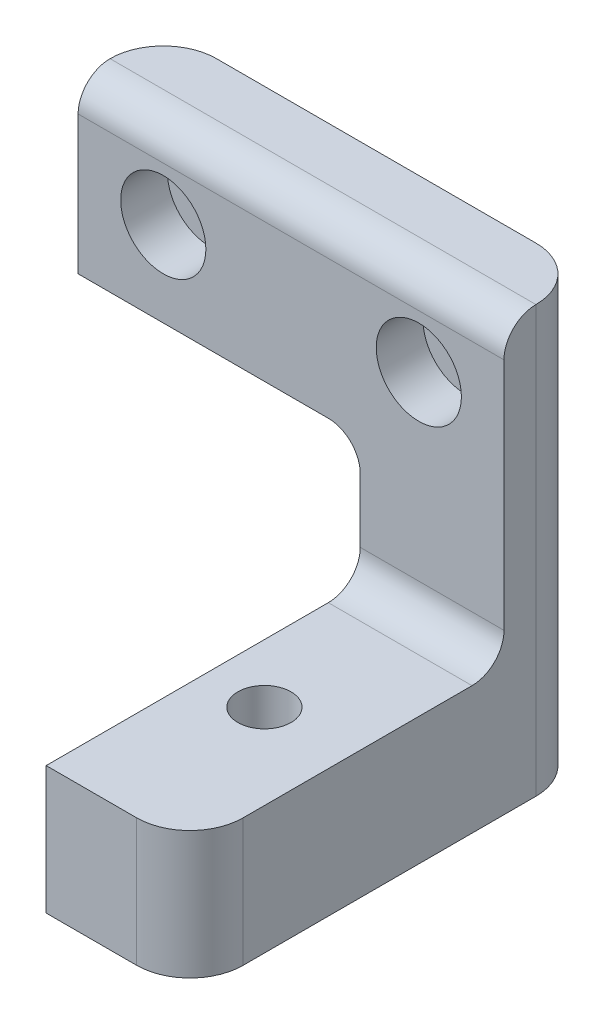
from build123d import *

# Parameters (mm, degrees)
SKETCH1_W                                           = 40
SKETCH1_H                                           = 37.5
BOSS_EXTRUDE1_DEPTH                                 = 40
CUT_EXTRUDE1_REACH                                  = 61.595
SKETCH2_W                                           = 29.5
SKETCH2_H                                           = 28
FILLET1_R                                           = 3
M6_TAPPED_HOLE1_D                                   = 5
M6_TAPPED_HOLE1_CSINK_D                             = 6.05
M6_TAPPED_HOLE1_CSINK_ANGLE                         = 90
FILLET2_R                                           = 5
CUT_EXTRUDE2_REACH                                  = 50.493
SKETCH7_W                                           = 13
SKETCH7_H                                           = 29.5
CUT_EXTRUDE3_REACH                                  = 50.493
SKETCH8_W                                           = 29.5
SKETCH8_H                                           = 37
CUT_EXTRUDE4_REACH                                  = 61.595
SKETCH9_W                                           = 8
SKETCH9_H                                           = 23.997787144
FILLET5_R                                           = 3
CBORE_FOR_M4_HEX_SOCKET_HEAD_CAP_SCREW1_D           = 4.3
CBORE_FOR_M4_HEX_SOCKET_HEAD_CAP_SCREW1_CBORE_D     = 8
CBORE_FOR_M4_HEX_SOCKET_HEAD_CAP_SCREW1_CBORE_DEPTH = 4.4


with BuildPart() as part:
    # Sketch1 → Boss-Extrude1 (new body)
    with BuildSketch(Plane(origin=(0, 0, 0), x_dir=(1, 0, 0), z_dir=(0, 1, 0))):
        Rectangle(SKETCH1_W, SKETCH1_H)
    extrude(amount=-BOSS_EXTRUDE1_DEPTH)

    # Sketch2 → Cut-Extrude1 (cut, up to next)
    with BuildSketch(Plane(origin=(20, 0, 0), x_dir=(0, 0, -1), z_dir=(1, 0, 0)), mode=Mode.PRIVATE) as cut_extrude1_sk1:
        with Locations((-4, -14)):
            Rectangle(SKETCH2_W, SKETCH2_H)
    cut_extrude1_tool1 = extrude(cut_extrude1_sk1.sketch, amount=-CUT_EXTRUDE1_REACH, mode=Mode.PRIVATE) & part.part
    add(cut_extrude1_tool1.solids().sort_by_distance((20, -14, 4))[0], mode=Mode.SUBTRACT)

    # Fillet1
    fillet1_edges = [part.edges().sort_by_distance(p)[0] for p in [
        (0, 0, -10.75),
        (0, -28, -10.75),
    ]]
    fillet(fillet1_edges, radius=FILLET1_R)

    # M6 Tapped Hole1 (through all)
    with Locations(Plane(origin=(0, -40, 0), x_dir=(-1, 0, 0), z_dir=(0, -1, 0))):
        with Locations((-12, -3.75)):
            CounterSinkHole(M6_TAPPED_HOLE1_D / 2, M6_TAPPED_HOLE1_CSINK_D / 2, counter_sink_angle=M6_TAPPED_HOLE1_CSINK_ANGLE)

    # Fillet2
    fillet2_edges = [part.edges().sort_by_distance(p)[0] for p in [
        (20, -20, -18.75),
        (20, -34, 18.75),
        (-20, -34, 18.75),
        (-20, -20, -18.75),
    ]]
    fillet(fillet2_edges, radius=FILLET2_R)

    # Sketch7 → Cut-Extrude2 (cut, up to next)
    with BuildSketch(Plane(origin=(0, 0, 0), x_dir=(1, 0, 0), z_dir=(0, 1, 0)), mode=Mode.PRIVATE) as cut_extrude2_sk1:
        with Locations((0, -4)):
            Rectangle(SKETCH7_W, SKETCH7_H)
    cut_extrude2_tool1 = extrude(cut_extrude2_sk1.sketch, amount=-CUT_EXTRUDE2_REACH, mode=Mode.PRIVATE) & part.part
    add(cut_extrude2_tool1.solids().sort_by_distance((0, 0, 4))[0], mode=Mode.SUBTRACT)

    # Sketch8 → Cut-Extrude3 (cut, up to next)
    with BuildSketch(Plane(origin=(0, 0, 0), x_dir=(0, 0, -1), z_dir=(1, 0, 0)), mode=Mode.PRIVATE) as cut_extrude3_sk1:
        with Locations((-4, -21.5)):
            Rectangle(SKETCH8_W, SKETCH8_H)
    cut_extrude3_tool1 = extrude(cut_extrude3_sk1.sketch, amount=-CUT_EXTRUDE3_REACH, mode=Mode.PRIVATE) & part.part
    add(cut_extrude3_tool1.solids().sort_by_distance((0, -21.5, 4))[0], mode=Mode.SUBTRACT)

    # Cut-Extrude4: up to this face of the body (flat: up to its plane)
    cut_extrude4_end = Plane(part.part.faces().sort_by_distance((6.5, -33.963805531, 3.923597235))[0])
    # Sketch9 → Cut-Extrude4 (cut, up to the picked face)
    with BuildSketch(Plane.ZY.offset(20), mode=Mode.PRIVATE) as cut_extrude4_sk1:
        with Locations((-14.75, -28.001106428)):
            Rectangle(SKETCH9_W, SKETCH9_H)
    cut_extrude4_tool1 = split(extrude(cut_extrude4_sk1.sketch, amount=-CUT_EXTRUDE4_REACH, mode=Mode.PRIVATE), bisect_by=cut_extrude4_end, keep=Keep.BOTH, mode=Mode.PRIVATE)
    add(cut_extrude4_tool1.solids().sort_by(Axis((-20, -28.001106, -14.75), (1, 0, 0)))[0], mode=Mode.SUBTRACT)

    # Fillet5
    fillet5_edges = [part.edges().sort_by_distance(p)[0] for p in [
        (6.5, -16.002212856, -14.75),
    ]]
    fillet(fillet5_edges, radius=FILLET5_R)

    # CBORE for M4 Hex Socket Head Cap Screw1 (through all)
    with Locations(Plane.XY.offset(-10.75)):
        with Locations((-12, -8.001106428), (12, -8.001106428)):
            CounterBoreHole(CBORE_FOR_M4_HEX_SOCKET_HEAD_CAP_SCREW1_D / 2, CBORE_FOR_M4_HEX_SOCKET_HEAD_CAP_SCREW1_CBORE_D / 2, CBORE_FOR_M4_HEX_SOCKET_HEAD_CAP_SCREW1_CBORE_DEPTH)


solid = part.part
